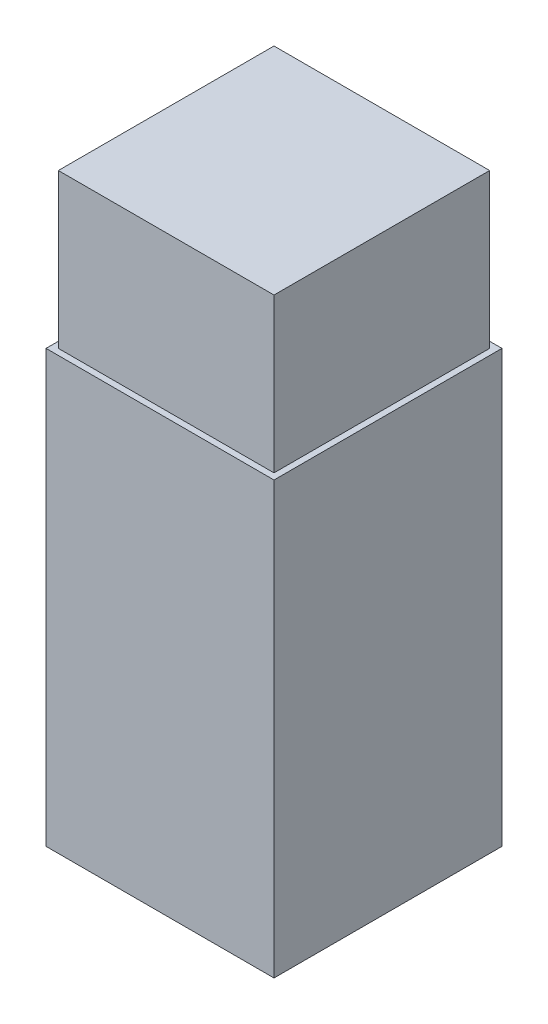
from build123d import *

# Parameters (mm, degrees)
SKETCH1_W           = 37
SKETCH1_H           = 37
BOSS_EXTRUDE1_DEPTH = 70
SKETCH2_W           = 35
SKETCH2_H           = 35
BOSS_EXTRUDE2_DEPTH = 25


with BuildPart() as part:
    # Sketch1 → Boss-Extrude1 (new body)
    with BuildSketch(Plane(origin=(0, 0, 0), x_dir=(1, 0, 0), z_dir=(0, 1, 0))):
        with Locations((18.5, 18.5)):
            Rectangle(SKETCH1_W, SKETCH1_H)
    extrude(amount=BOSS_EXTRUDE1_DEPTH)

    # Sketch2 → Boss-Extrude2 (add)
    with BuildSketch(Plane(origin=(0, 70, 0), x_dir=(1, 0, 0), z_dir=(0, 1, 0))):
        with Locations((18.5, 18.5)):
            Rectangle(SKETCH2_W, SKETCH2_H)
    extrude(amount=BOSS_EXTRUDE2_DEPTH)


solid = part.part
